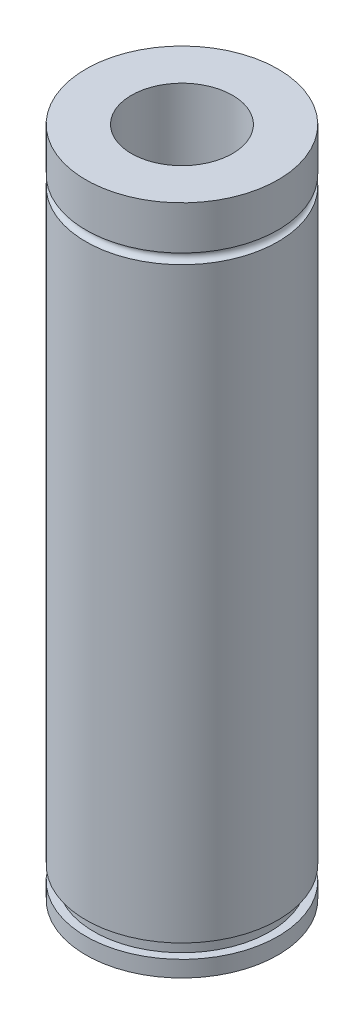
from build123d import *


with BuildPart() as part:
    # Sketch1 → Revolve1 (revolve)
    with BuildSketch(Plane.XY, mode=Mode.PRIVATE) as revolve1_sk:
        with BuildLine():
            Line((0, 0), (47.5, 0))
            Line((47.5, 0), (47.5, 8))
            Line((47.5, 8), (43.5, 8))
            Line((43.5, 8), (43.5, 15))
            Line((43.5, 15), (47.5, 15))
            Line((47.5, 15), (47.5, 305.5))
            ThreePointArc((47.5, 305.5), (45, 308), (47.5, 310.5))
            Line((47.5, 310.5), (47.5, 332))
            Line((47.5, 332), (25, 332))
            Line((25, 332), (25, 82))
            Line((25, 82), (0, 82))
            Line((0, 82), (0, 0))
        make_face()
    revolve(revolve1_sk.sketch.rotate(Axis((0, 0, 0), (0, 1, 0)), 90), axis=Axis((0, 0, 0), (0, 1, 0)))


solid = part.part
